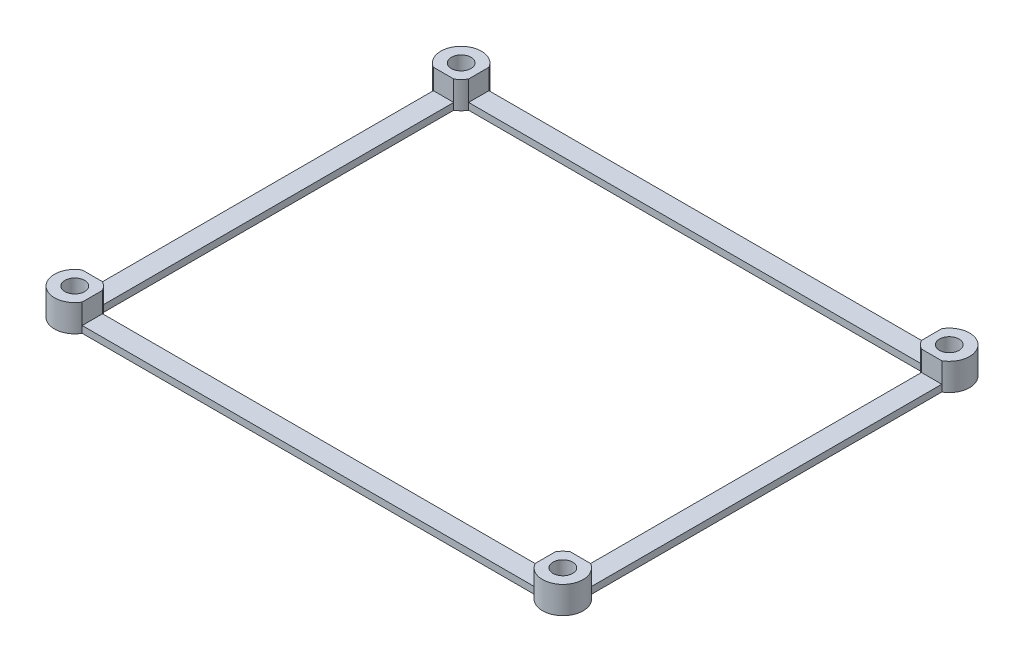
from build123d import *

# Parameters (mm, degrees)
SKETCH1_R           = 1.45
BOSS_EXTRUDE1_DEPTH = 4
SKETCH2_W           = 3
SKETCH2_H           = 51.803847578
SKETCH2_W_2         = 66.803847578
SKETCH2_H_2         = 3
CUT_EXTRUDE1_DEPTH  = 3


with BuildPart() as part:
    # Sketch1 → Boss-Extrude1 (new body)
    with BuildSketch(Plane(origin=(0, 0, 0), x_dir=(1, 0, 0), z_dir=(0, 1, 0))):
        with BuildLine():
            Line((-33.401923789, 30), (33.401923789, 30))
            ThreePointArc((33.401923789, 30), (38.121320344, 30.621320344), (37.5, 25.901923789))
            Line((37.5, 25.901923789), (37.5, -25.901923789))
            ThreePointArc((37.5, -25.901923789), (38.121320344, -30.621320344), (33.401923789, -30))
            Line((33.401923789, -30), (-33.401923789, -30))
            ThreePointArc((-33.401923789, -30), (-38.121320344, -30.621320344), (-37.5, -25.901923789))
            Line((-37.5, -25.901923789), (-37.5, 25.901923789))
            ThreePointArc((-37.5, 25.901923789), (-38.121320344, 30.621320344), (-33.401923789, 30))
        make_face()
        with Locations(Location((36, 28.5, 0), (0, 0, 270))):
            Circle(SKETCH1_R, mode=Mode.SUBTRACT)
        with Locations(Location((36, -28.5, 0), (0, 0, 270))):
            Circle(SKETCH1_R, mode=Mode.SUBTRACT)
        with Locations(Location((-36, -28.5, 0), (0, 0, 270))):
            Circle(SKETCH1_R, mode=Mode.SUBTRACT)
        with Locations(Location((-36, 28.5, 0), (0, 0, 270))):
            Circle(SKETCH1_R, mode=Mode.SUBTRACT)
        with BuildLine():
            Line((-33.401923789, 27), (33.401923789, 27))
            ThreePointArc((33.401923789, 27), (33.878679656, 26.378679656), (34.5, 25.901923789))
            Line((34.5, 25.901923789), (34.5, -25.901923789))
            ThreePointArc((34.5, -25.901923789), (33.878679656, -26.378679656), (33.401923789, -27))
            Line((33.401923789, -27), (-33.401923789, -27))
            ThreePointArc((-33.401923789, -27), (-33.878679656, -26.378679656), (-34.5, -25.901923789))
            Line((-34.5, -25.901923789), (-34.5, 25.901923789))
            ThreePointArc((-34.5, 25.901923789), (-33.878679656, 26.378679656), (-33.401923789, 27))
        make_face(mode=Mode.SUBTRACT)
    extrude(amount=BOSS_EXTRUDE1_DEPTH)

    # Sketch2 → Cut-Extrude1 (cut)
    with BuildSketch(Plane(origin=(0, 4, 0), x_dir=(1, 0, 0), z_dir=(0, 1, 0))):
        with Locations((-36, 0)):
            Rectangle(SKETCH2_W, SKETCH2_H)
        with Locations((0, -28.5)):
            Rectangle(SKETCH2_W_2, SKETCH2_H_2)
        with Locations((36, 0)):
            Rectangle(SKETCH2_W, SKETCH2_H)
        with Locations((0, 28.5)):
            Rectangle(SKETCH2_W_2, SKETCH2_H_2)
    extrude(amount=-CUT_EXTRUDE1_DEPTH, mode=Mode.SUBTRACT)


solid = part.part
